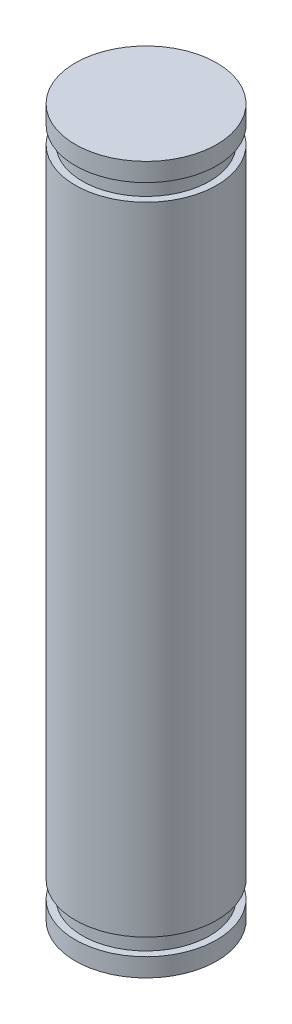
from build123d import *


with BuildPart() as part:
    # 草图1 → 旋转1 (revolve)
    with BuildSketch(Plane.XY, mode=Mode.PRIVATE) as revolve_1_sk:
        Polygon((0, 0), (5, 0), (5, 1.3), (4.5, 1.3), (4.5, 2.5), (5, 2.5), (5, 47.5), (4.5, 47.5), (4.5, 48.7), (5, 48.7), (5, 50), (0, 50), align=None)
    revolve(revolve_1_sk.sketch.rotate(Axis((0, 0, 0), (0, 1, 0)), 90), axis=Axis((0, 0, 0), (0, 1, 0)))


solid = part.part
